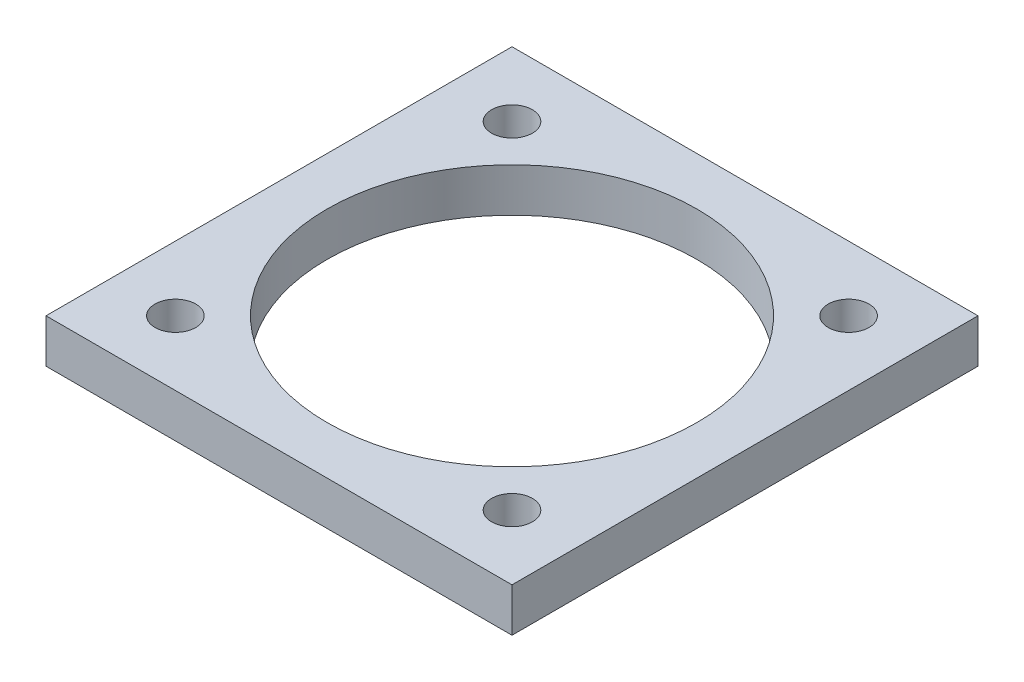
from build123d import *

# Parameters (mm, degrees)
SKETCH1_W           = 32
SKETCH1_H           = 32
SKETCH1_R           = 1.4
SKETCH1_R_2         = 12.7
BOSS_EXTRUDE1_DEPTH = 3


with BuildPart() as part:
    # Sketch1 → Boss-Extrude1 (new body)
    with BuildSketch(Plane(origin=(0, 0, 0), x_dir=(1, 0, 0), z_dir=(0, 1, 0))):
        Rectangle(SKETCH1_W, SKETCH1_H)
        with Locations(Location((-11.557, -11.557, 0), (0, 0, 270))):
            Circle(SKETCH1_R, mode=Mode.SUBTRACT)
        with Locations(Location((11.557, -11.557, 0), (0, 0, 270))):
            Circle(SKETCH1_R, mode=Mode.SUBTRACT)
        with Locations(Location((11.557, 11.557, 0), (0, 0, 270))):
            Circle(SKETCH1_R, mode=Mode.SUBTRACT)
        with Locations(Location((-11.557, 11.557, 0), (0, 0, 270))):
            Circle(SKETCH1_R, mode=Mode.SUBTRACT)
        with Locations(Location((0, 0, 0), (0, 0, 270))):
            Circle(SKETCH1_R_2, mode=Mode.SUBTRACT)
    extrude(amount=BOSS_EXTRUDE1_DEPTH)


solid = part.part
